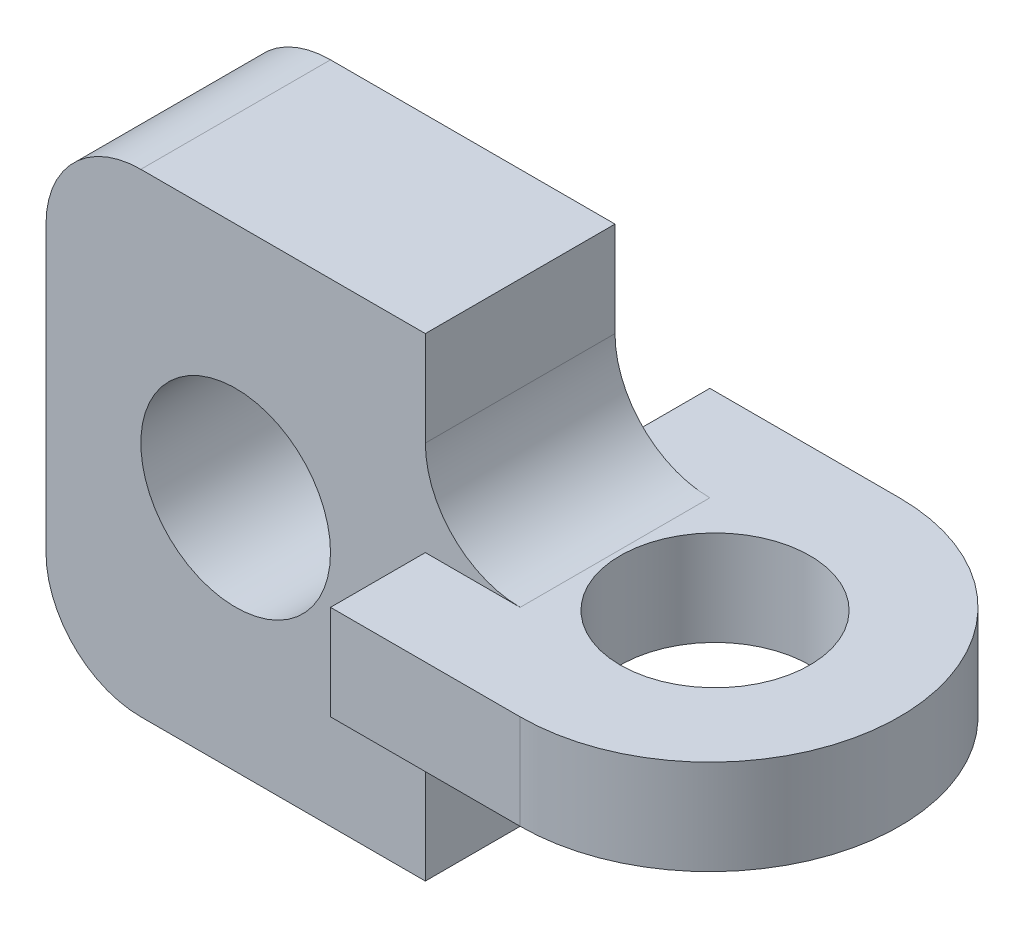
from build123d import *

# Parameters (mm, degrees)
SKETCH1_R           = 10
BOSS_EXTRUDE1_DEPTH = 10
SKETCH2_W           = 20
SKETCH2_H           = 50
BOSS_EXTRUDE2_DEPTH = 40
SKETCH3_OUTSIDE_W   = 102.494
SKETCH3_OUTSIDE_H   = 72.494
SKETCH3_OUTSIDE_R   = 10
CUT_EXTRUDE1_DEPTH  = 40
BOSS_EXTRUDE3_DEPTH = 20


with BuildPart() as part:
    # Sketch1 → Boss-Extrude1 (new body)
    with BuildSketch(Plane(origin=(0, 0, 0), x_dir=(1, 0, 0), z_dir=(0, 1, 0))):
        with BuildLine():
            Line((-0.548861483, 20), (-20.548861483, 20))
            Line((-20.548861483, 20), (-20.548861483, -20))
            Line((-20.548861483, -20), (-0.548861483, -20))
            ThreePointArc((-0.548861483, -20), (19.451138517, 0), (-0.548861483, 20))
        make_face()
        with Locations(Location((0, 0, 0), (0, 0, 270))):
            Circle(SKETCH1_R, mode=Mode.SUBTRACT)
    extrude(amount=BOSS_EXTRUDE1_DEPTH)

    # Sketch2 → Boss-Extrude2 (add)
    with BuildSketch(Plane.ZY.offset(20.548861483)):
        with Locations((0, 5)):
            Rectangle(SKETCH2_W, SKETCH2_H)
    extrude(amount=BOSS_EXTRUDE2_DEPTH)

    # Sketch3 outside → Cut-Extrude1 (cut)
    # profile 1 of 2: a face of its own
    with BuildSketch(Plane.XY.offset(10)):
        with Locations((-20.549, 5)):
            Rectangle(SKETCH3_OUTSIDE_W, SKETCH3_OUTSIDE_H)
        with BuildLine():
            Line((-50.548861483, 30), (-20.548861483, 30))
            Line((-20.548861483, 30), (-20.548861483, 10))
            Line((-20.548861483, 10), (19.451138517, 10))
            Line((19.451138517, 10), (19.451138517, 0))
            Line((19.451138517, 0), (-20.548861483, 0))
            Line((-20.548861483, 0), (-20.548861483, -20))
            Line((-20.548861483, -20), (-50.548861483, -20))
            ThreePointArc((-50.548861483, -20), (-57.619929295, -17.071067812), (-60.548861483, -10))
            Line((-60.548861483, -10), (-60.548861483, 20))
            ThreePointArc((-60.548861483, 20), (-57.619929295, 27.071067812), (-50.548861483, 30))
        make_face(mode=Mode.SUBTRACT)
    # profile 2 of 2: a face of its own
    with BuildSketch(Plane.XY.offset(10)):
        with Locations((-40.548861483, 5)):
            Circle(SKETCH3_OUTSIDE_R)
    extrude(amount=-CUT_EXTRUDE1_DEPTH, mode=Mode.SUBTRACT)

    # Sketch4 → Boss-Extrude3 (add)
    with BuildSketch(Plane.XY.offset(10)):
        with BuildLine():
            Line((-20.548861483, 0), (-20.548861483, -10))
            ThreePointArc((-20.548861483, -10), (-17.619929295, -2.928932188), (-10.548861483, 0))
            Line((-10.548861483, 0), (-20.548861483, 0))
        make_face()
        with BuildLine():
            Line((-20.548861483, 20), (-20.548861483, 10))
            Line((-20.548861483, 10), (-10.548861483, 10))
            ThreePointArc((-10.548861483, 10), (-17.619929295, 12.928932188), (-20.548861483, 20))
        make_face()
    extrude(amount=-BOSS_EXTRUDE3_DEPTH)


solid = part.part
